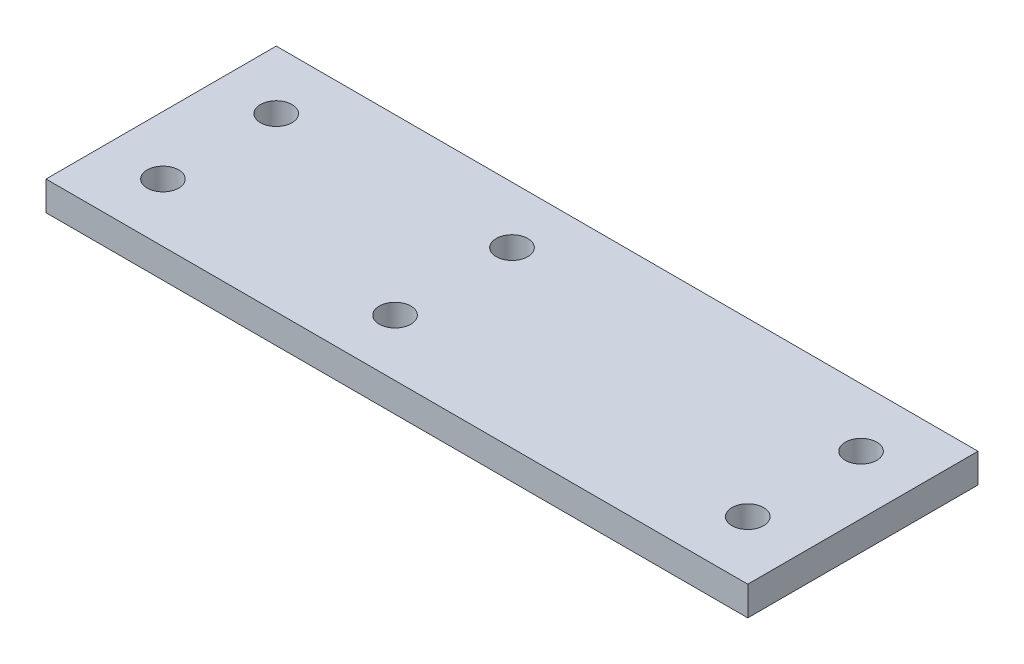
from build123d import *

# Parameters (mm, degrees)
SKETCH1_W           = 152.4
SKETCH1_H           = 50
BOSS_EXTRUDE1_DEPTH = 6.35
CUT_EXTRUDE2_REACH  = 82.447
SKETCH3_R           = 3.429


with BuildPart() as part:
    # Sketch1 → Boss-Extrude1 (new body)
    with BuildSketch(Plane(origin=(0, 0, 0), x_dir=(1, 0, 0), z_dir=(0, 1, 0))):
        Rectangle(SKETCH1_W, SKETCH1_H)
    extrude(amount=BOSS_EXTRUDE1_DEPTH)

    # Sketch3 → Cut-Extrude2 (cut, up to next)
    with BuildSketch(Plane.XZ, mode=Mode.PRIVATE) as cut_extrude2_sk1:
        with Locations(Location((-63.5, 12.3, 0), (0, 0, 270))):
            Circle(SKETCH3_R)
    cut_extrude2_tool1 = extrude(cut_extrude2_sk1.sketch, amount=-CUT_EXTRUDE2_REACH, mode=Mode.PRIVATE) & part.part
    # Sketch3 → Cut-Extrude2 (cut, up to next)
    with BuildSketch(Plane.XZ, mode=Mode.PRIVATE) as cut_extrude2_sk2:
        with Locations(Location((-63.5, -12.3, 0), (0, 0, 90))):
            Circle(SKETCH3_R)
    cut_extrude2_tool2 = extrude(cut_extrude2_sk2.sketch, amount=-CUT_EXTRUDE2_REACH, mode=Mode.PRIVATE) & part.part
    # Sketch3 → Cut-Extrude2 (cut, up to next)
    with BuildSketch(Plane.XZ, mode=Mode.PRIVATE) as cut_extrude2_sk3:
        with Locations(Location((63.5, 12.3, 0), (0, 0, 90))):
            Circle(SKETCH3_R)
    cut_extrude2_tool3 = extrude(cut_extrude2_sk3.sketch, amount=-CUT_EXTRUDE2_REACH, mode=Mode.PRIVATE) & part.part
    # Sketch3 → Cut-Extrude2 (cut, up to next)
    with BuildSketch(Plane.XZ, mode=Mode.PRIVATE) as cut_extrude2_sk4:
        with Locations(Location((63.5, -12.3, 0), (0, 0, 270))):
            Circle(SKETCH3_R)
    cut_extrude2_tool4 = extrude(cut_extrude2_sk4.sketch, amount=-CUT_EXTRUDE2_REACH, mode=Mode.PRIVATE) & part.part
    # Sketch3 → Cut-Extrude2 (cut, up to next)
    with BuildSketch(Plane.XZ, mode=Mode.PRIVATE) as cut_extrude2_sk5:
        with Locations(Location((-12.698950153, 12.699994489, 0), (0, 0, 270))):
            Circle(SKETCH3_R)
    cut_extrude2_tool5 = extrude(cut_extrude2_sk5.sketch, amount=-CUT_EXTRUDE2_REACH, mode=Mode.PRIVATE) & part.part
    # Sketch3 → Cut-Extrude2 (cut, up to next)
    with BuildSketch(Plane.XZ, mode=Mode.PRIVATE) as cut_extrude2_sk6:
        with Locations(Location((-12.698950153, -12.699994489, 0), (0, 0, 270))):
            Circle(SKETCH3_R)
    cut_extrude2_tool6 = extrude(cut_extrude2_sk6.sketch, amount=-CUT_EXTRUDE2_REACH, mode=Mode.PRIVATE) & part.part
    add(cut_extrude2_tool1.solids().sort_by_distance((-63.5, 0, 12.3))[0], mode=Mode.SUBTRACT)
    add(cut_extrude2_tool2.solids().sort_by_distance((-63.5, 0, -12.3))[0], mode=Mode.SUBTRACT)
    add(cut_extrude2_tool3.solids().sort_by_distance((63.5, 0, 12.3))[0], mode=Mode.SUBTRACT)
    add(cut_extrude2_tool4.solids().sort_by_distance((63.5, 0, -12.3))[0], mode=Mode.SUBTRACT)
    add(cut_extrude2_tool5.solids().sort_by_distance((-12.69895, 0, 12.699994))[0], mode=Mode.SUBTRACT)
    add(cut_extrude2_tool6.solids().sort_by_distance((-12.69895, 0, -12.699994))[0], mode=Mode.SUBTRACT)


solid = part.part
